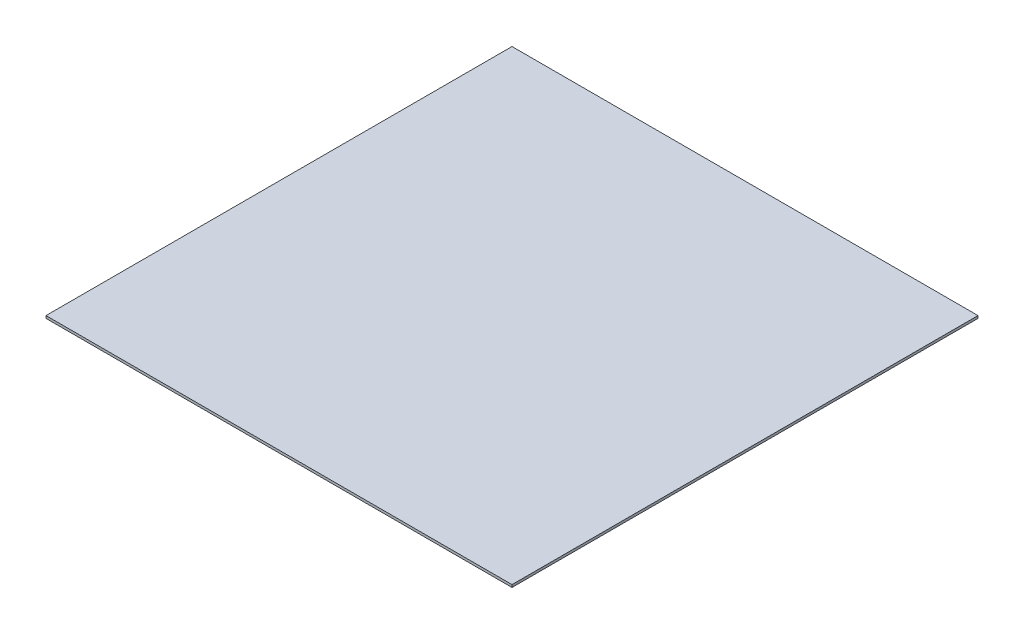
from build123d import *

# Parameters (mm, degrees)
SKETCH1_W           = 300
SKETCH1_H           = 300
BOSS_EXTRUDE1_DEPTH = 1.6


with BuildPart() as part:
    # Sketch1 → Boss-Extrude1 (new body)
    with BuildSketch(Plane(origin=(0, 0, 0), x_dir=(1, 0, 0), z_dir=(0, 1, 0))):
        with Locations((150, 150)):
            Rectangle(SKETCH1_W, SKETCH1_H)
    extrude(amount=BOSS_EXTRUDE1_DEPTH)


solid = part.part
